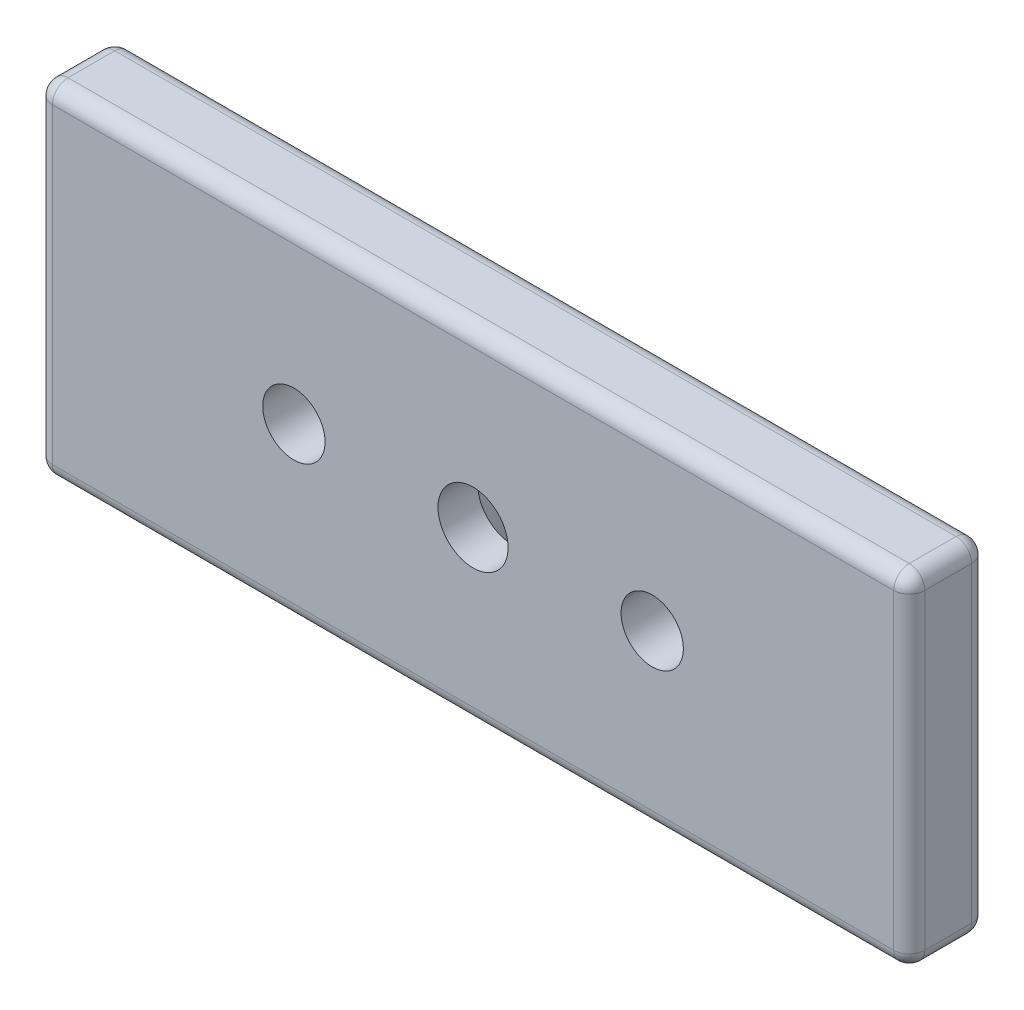
from build123d import *

# Parameters (mm, degrees)
SKETCH2_W                                       = 56
SKETCH2_H                                       = 22
BOSS_EXTRUDE2_DEPTH                             = 5
SKETCH5_R                                       = 2
MOUNTING_HOLES_DEPTH                            = 61.373835392
SMALL_EDGE_FILLET_R                             = 1
FRONT_BACK_EDGE_FILLET_R                        = 1
CSK_FOR_M4_FLAT_HEAD_MACHINE_SCREW2_D           = 4.5
CSK_FOR_M4_FLAT_HEAD_MACHINE_SCREW2_CSINK_D     = 9.4
CSK_FOR_M4_FLAT_HEAD_MACHINE_SCREW2_CSINK_ANGLE = 90


with BuildPart() as part:
    # Sketch2 → Boss-Extrude2 (new body)
    with BuildSketch(Plane.XY):
        with Locations((28, 11)):
            Rectangle(SKETCH2_W, SKETCH2_H)
    extrude(amount=-BOSS_EXTRUDE2_DEPTH)

    # Sketch5 → Mounting Holes (cut, through all)
    with BuildSketch(Plane.XY):
        with Locations((16.5, 11)):
            Circle(SKETCH5_R)
        with Locations((39.5, 11)):
            Circle(SKETCH5_R)
    extrude(amount=-MOUNTING_HOLES_DEPTH, mode=Mode.SUBTRACT)

    # Small Edge Fillet
    small_edge_fillet_edges = [part.edges().sort_by_distance(p)[0] for p in [
        (0, 22, -2.5),
        (56, 22, -2.5),
        (56, 0, -2.5),
        (0, 0, -2.5),
    ]]
    fillet(small_edge_fillet_edges, radius=SMALL_EDGE_FILLET_R)

    # Front-Back Edge Fillet
    front_back_edge_fillet_edges = [part.edges().sort_by_distance(p)[0] for p in [
        (0, 11, 0),
        (0, 11, -5),
        (28, 0, 0),
        (56, 11, 0),
        (28, 22, 0),
        (0.292893219, 21.707106781, 0),
        (55.707106781, 21.707106781, 0),
        (55.707106781, 0.292893219, 0),
        (0.292893219, 0.292893219, 0),
        (28, 0, -5),
        (28, 22, -5),
        (56, 11, -5),
        (0.292893219, 21.707106781, -5),
        (55.707106781, 21.707106781, -5),
        (55.707106781, 0.292893219, -5),
        (0.292893219, 0.292893219, -5),
    ]]
    fillet(front_back_edge_fillet_edges, radius=FRONT_BACK_EDGE_FILLET_R)

    # CSK for M4 Flat Head Machine Screw2 (through all)
    with Locations(Plane(origin=(0, 0, -5), x_dir=(-1, 0, 0), z_dir=(0, 0, -1))):
        with Locations((-28, 11)):
            CounterSinkHole(CSK_FOR_M4_FLAT_HEAD_MACHINE_SCREW2_D / 2, CSK_FOR_M4_FLAT_HEAD_MACHINE_SCREW2_CSINK_D / 2, counter_sink_angle=CSK_FOR_M4_FLAT_HEAD_MACHINE_SCREW2_CSINK_ANGLE)


solid = part.part
